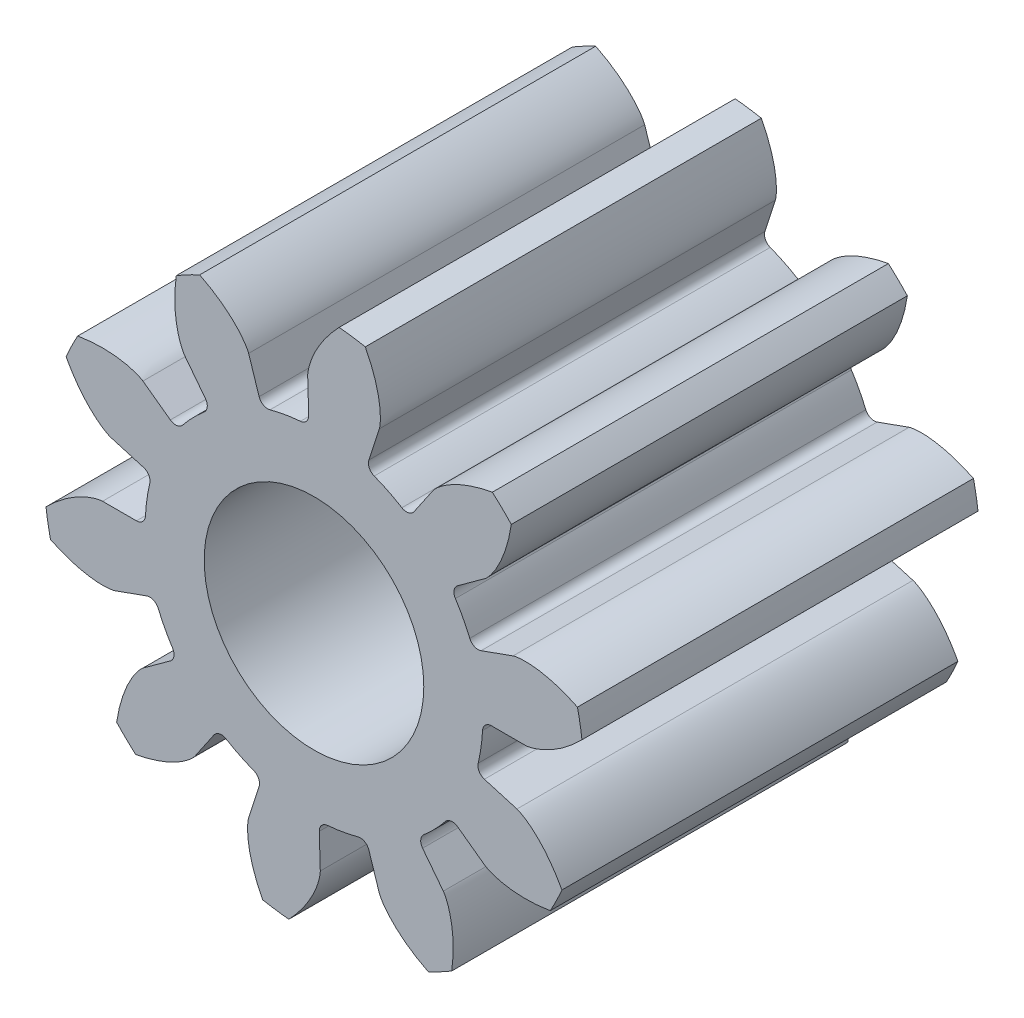
from build123d import *

# Parameters (mm, degrees)
SKETCH3_R           = 3
BOSS_EXTRUDE1_DEPTH = 4.4
CUT_EXTRUDE3_DEPTH  = 7.112282716
CIRPATTERN2_COUNT   = 10
SKETCH9_R           = 1.22
CUT_EXTRUDE4_DEPTH  = 7.094802616
FILLET2_R           = 0.1


with BuildPart() as part:
    # Sketch3 → Boss-Extrude1 (new body)
    with BuildSketch(Plane.XY):
        Circle(SKETCH3_R)
    extrude(amount=BOSS_EXTRUDE1_DEPTH)

    # Sketch4 → Cut-Extrude3 (cut, symmetric)
    with BuildSketch(Plane.XY):
        with BuildLine():
            add(Edge.make_bspline(
                [(2.349231552, 0), (2.353178135, 7.5159e-05), (2.360626614, 0.000652498), (2.372742868, 0.002064126), (2.396521523, 0.006048082), (2.423159233, 0.012180222), (2.452933214, 0.020698029), (2.484560398, 0.03142847), (2.511343649, 0.04157376), (2.537796689, 0.052589027), (2.56389365, 0.064364034), (2.595179051, 0.079563993), (2.632222744, 0.099086764), (2.674768452, 0.123761569), (2.722081699, 0.153913195), (2.769204605, 0.186903939), (2.814641627, 0.221209232), (2.859392748, 0.257927311), (2.901865044, 0.29490935), (2.937519554, 0.328576339), (2.960682919, 0.351195674), (2.974020241, 0.364669524), (2.977337769, 0.368048647)],
                knots=[0, 0, 0, 0, 0, 0.015083688, 0.02853182, 0.046610139, 0.092110525, 0.119476175, 0.146842495, 0.174208854, 0.201574955, 0.228941013, 0.256307345, 0.307035032, 0.361767351, 0.41649966, 0.471231936, 0.525964281, 0.580696615, 0.635428982, 0.690161387, 0.708221783, 0.708221783, 0.708221783, 0.708221783, 0.708221783], degree=4))
            Line((2.349231552, 0), (1.875, 0))
            ThreePointArc((1.875, 0), (1.856081461, -0.265681404), (1.799707617, -0.526001418))
            Line((1.799707617, -0.526001418), (2.254895957, -0.659039534))
            add(Edge.make_bspline(
                [(2.254895957, -0.659039534), (2.258662977, -0.660218827), (2.265650392, -0.662862534), (2.276884096, -0.667616499), (2.298590262, -0.678111199), (2.322438035, -0.691469883), (2.348626879, -0.707998267), (2.375973789, -0.72717032), (2.398835434, -0.74442183), (2.421136069, -0.762415749), (2.442881792, -0.781039007), (2.468646791, -0.804405219), (2.498726157, -0.833536053), (2.532641279, -0.869155539), (2.569596059, -0.911369377), (2.605571672, -0.956254929), (2.639560324, -1.001929294), (2.672213749, -1.049727139), (2.702605807, -1.097139057), (2.727383839, -1.139456421), (2.743271562, -1.16766557), (2.752293438, -1.184339938), (2.754529789, -1.188514049)],
                knots=[0, 0, 0, 0, 0, 0.015083688, 0.02853182, 0.046610139, 0.092110525, 0.119476175, 0.146842495, 0.174208854, 0.201574955, 0.228941013, 0.256307345, 0.307035032, 0.361767351, 0.41649966, 0.471231936, 0.525964281, 0.580696615, 0.635428982, 0.690161387, 0.708221783, 0.708221783, 0.708221783, 0.708221783, 0.708221783], degree=4))
            ThreePointArc((2.754529789, -1.188514049), (2.937991607, -0.60679924), (3, 0))
            ThreePointArc((3, 0), (2.994329082, 0.184372844), (2.977337769, 0.368048647))
        make_face()
    cut_extrude3 = extrude(amount=CUT_EXTRUDE3_DEPTH, both=True, mode=Mode.SUBTRACT)

    # CirPattern2: Cut-Extrude3 ×10 about axis
    cirpattern2_axis = Axis((0, 0, 4.4), (0, 0, 1))
    for i in range(1, CIRPATTERN2_COUNT):
        add(cut_extrude3.rotate(cirpattern2_axis, i * 360 / CIRPATTERN2_COUNT), mode=Mode.SUBTRACT)

    # Sketch9 → Cut-Extrude4 (cut, through all)
    with BuildSketch(Plane.XY.offset(4.4)):
        Circle(SKETCH9_R)
    extrude(amount=-CUT_EXTRUDE4_DEPTH, mode=Mode.SUBTRACT)

    # Fillet2
    fillet2_edges = [part.edges().sort_by_distance(p)[0] for p in [
        (-1.516906864, 1.102097348, 2.2),
        (-1.146818171, 1.483385682, 2.2),
        (1.875, 0, 2.2),
        (1.799707617, -0.526001418, 2.2),
        (-1.875, 0, 2.2),
        (-1.799707617, 0.526001418, 2.2),
        (-1.516906864, -1.102097348, 2.2),
        (-1.765169924, -0.63229751, 2.2),
        (-0.579406864, -1.783230968, 2.2),
        (-1.056397315, -1.54908028, 2.2),
        (0.579406864, -1.783230968, 2.2),
        (0.055883163, -1.874167034, 2.2),
        (1.516906864, -1.102097348, 2.2),
        (1.146818171, -1.483385682, 2.2),
        (1.516906864, 1.102097348, 2.2),
        (1.765169924, 0.63229751, 2.2),
        (0.579406864, 1.783230968, 2.2),
        (1.056397315, 1.54908028, 2.2),
        (-0.579406864, 1.783230968, 2.2),
        (-0.055883163, 1.874167034, 2.2),
    ]]
    fillet(fillet2_edges, radius=FILLET2_R)


solid = part.part
